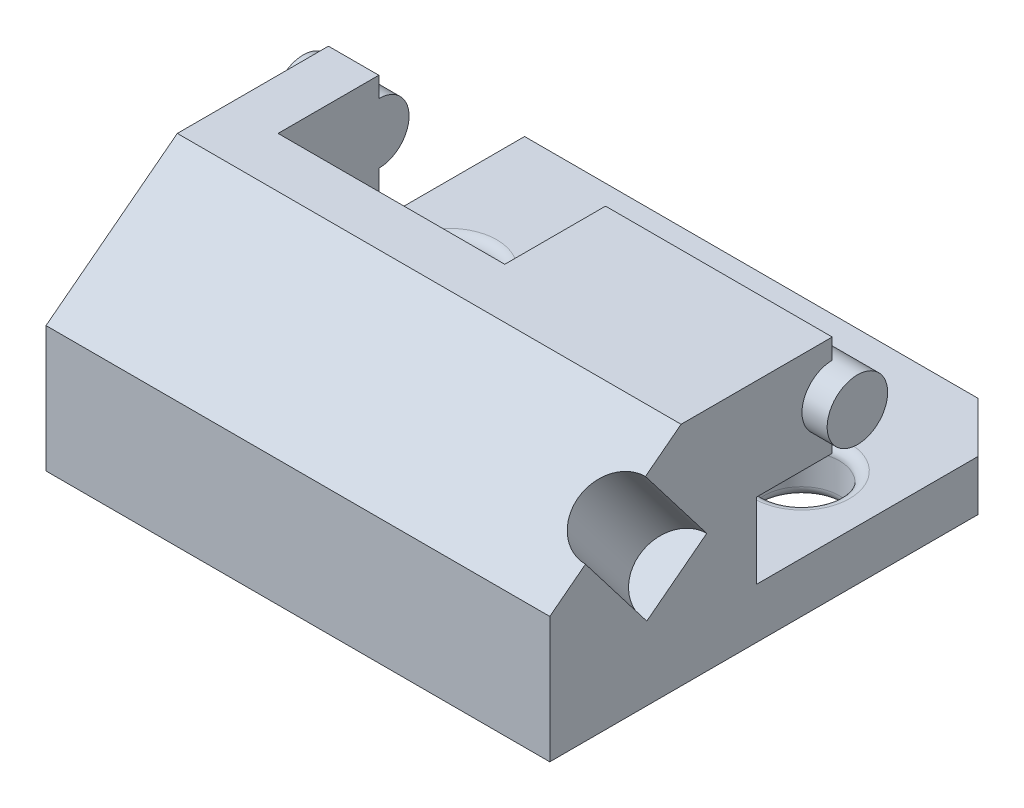
from build123d import *

# Parameters (mm, degrees)
EXTRUDE_1_DEPTH     = 100
SKETCH_2_R          = 6
EXTRUDE_2_DEPTH     = 105
EXTRUDE_START       = 5
SKETCH_2_2_R        = 6
EXTRUDE_3_DEPTH     = 5
CUT_EXTRUDE_1_REACH = 150.577
SKETCH_4_W          = 45
SKETCH_4_H          = 26
SKETCH_6_R          = 7.5
CUT_EXTRUDE_4_DEPTH = 20
SKETCH_7_R          = 7.5
CUT_EXTRUDE_5_DEPTH = 10
FILLET_1_R          = 2
CHAMFER_1_SIZE      = 10


with BuildPart() as part:
    # 草图1 → 凸台-拉伸1 (new body)
    with BuildSketch(Plane(origin=(0, 0, 0), x_dir=(0, 0, -1), z_dir=(1, 0, 0))):
        Polygon((0, 0), (95, 0), (95, 10), (41.064507457, 10), (41.064507457, 25), (56.064507457, 25), (56.064507457, 45), (26.064507457, 45), (0, 25), align=None)
    extrude(amount=EXTRUDE_1_DEPTH)

    # 草图2 → 凸台-拉伸2 (add)
    with BuildSketch(Plane(origin=(100, 0, 0), x_dir=(0, 0, -1), z_dir=(1, 0, 0))):
        with Locations((56.064507457, 35)):
            Circle(SKETCH_2_R)
    extrude(amount=-EXTRUDE_2_DEPTH)

    # 草图2<2> → 凸台-拉伸3 (add)
    with BuildSketch(Plane(origin=(100, 0, 0), x_dir=(0, 0, -1), z_dir=(1, 0, 0)).offset(EXTRUDE_START)):
        with Locations((56.064507457, 35)):
            Circle(SKETCH_2_2_R)
    extrude(amount=-EXTRUDE_3_DEPTH)

    # 切除-拉伸1: up to this face of the body (flat: up to its plane)
    cut_extrude_1_end = Plane(part.part.faces().sort_by_distance((50, 10, -68.032253728))[0])
    # 草图4 → 切除-拉伸1 (cut, up to the picked face)
    with BuildSketch(Plane(origin=(0, 45, 0), x_dir=(1, 0, 0), z_dir=(0, 1, 0)), mode=Mode.PRIVATE) as cut_extrude_1_sk1:
        with Locations((32.5, 49.064507457)):
            Rectangle(SKETCH_4_W, SKETCH_4_H)
    cut_extrude_1_tool1 = split(extrude(cut_extrude_1_sk1.sketch, amount=-CUT_EXTRUDE_1_REACH, mode=Mode.PRIVATE), bisect_by=cut_extrude_1_end, keep=Keep.BOTH, mode=Mode.PRIVATE)
    add(cut_extrude_1_tool1.solids().sort_by(Axis((32.5, 45, -49.064507), (0, -1, 0)))[0], mode=Mode.SUBTRACT)

    # 草图6 → 切除-拉伸4 (cut)
    with BuildSketch(Plane(origin=(0, 15.735238064, 12.074072829), x_dir=(1, 0, 0), z_dir=(0, 0.7933533402912367, 0.6087614290087189))):
        with Locations((100, 31.645832042)):
            Circle(SKETCH_6_R)
    extrude(amount=-CUT_EXTRUDE_4_DEPTH, mode=Mode.SUBTRACT)

    # 草图7 → 切除-拉伸5 (cut)
    with BuildSketch(Plane(origin=(0, 10, 0), x_dir=(1, 0, 0), z_dir=(0, 1, 0))):
        with Locations(Location((15, 65, 0), (0, 0, 270))):
            Circle(SKETCH_7_R)
        with Locations(Location((85, 65, 0), (0, 0, 270))):
            Circle(SKETCH_7_R)
        with BuildLine():
            Line((35, 72.5), (65, 72.5))
            ThreePointArc((65, 72.5), (72.5, 65), (65, 57.5))
            Line((65, 57.5), (35, 57.5))
            ThreePointArc((35, 57.5), (27.5, 65), (35, 72.5))
        make_face()
    extrude(amount=-CUT_EXTRUDE_5_DEPTH, mode=Mode.SUBTRACT)

    # 圆角1
    fillet_1_edges = [part.edges().sort_by_distance(p)[0] for p in [
        (15, 10, -72.5),
        (15, 0, -72.5),
        (85, 10, -72.5),
        (85, 0, -72.5),
        (27.5, 10, -65),
        (50, 10, -57.5),
        (72.5, 10, -65),
        (50, 10, -72.5),
        (27.5, 0, -65),
        (50, 0, -72.5),
        (72.5, 0, -65),
        (50, 0, -57.5),
    ]]
    fillet(fillet_1_edges, radius=FILLET_1_R)

    # 倒角1
    chamfer_1_edges = [part.edges().sort_by_distance(p)[0] for p in [
        (100, 5, -95),
    ]]
    chamfer(chamfer_1_edges, length=CHAMFER_1_SIZE)


solid = part.part
